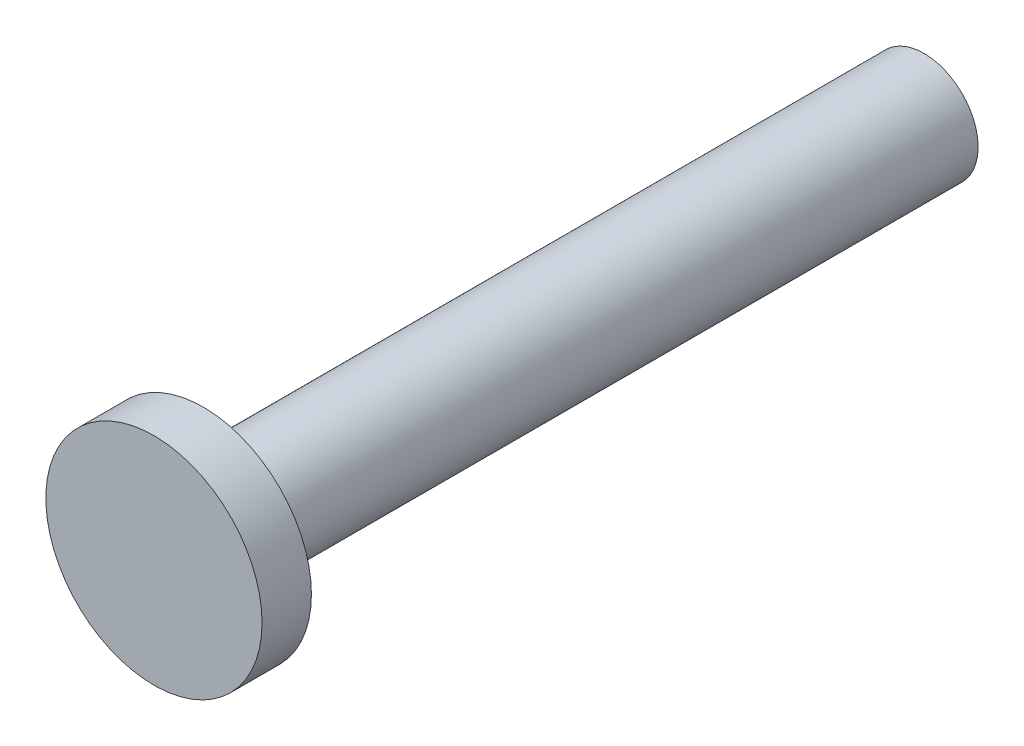
from build123d import *

# Parameters (mm, degrees)
ESQUISSE1_R        = 3
BOSS_EXTRU_1_DEPTH = 1.37
ESQUISSE2_R        = 1.5
BOSS_EXTRU_2_DEPTH = 20


with BuildPart() as part:
    # Esquisse1 → Boss.-Extru.1 (new body)
    with BuildSketch(Plane.XY):
        Circle(ESQUISSE1_R)
    extrude(amount=BOSS_EXTRU_1_DEPTH)

    # Esquisse2 → Boss.-Extru.2 (add)
    with BuildSketch(Plane(origin=(0, 0, 0), x_dir=(-1, 0, 0), z_dir=(0, 0, -1))):
        Circle(ESQUISSE2_R)
    extrude(amount=BOSS_EXTRU_2_DEPTH)


solid = part.part
